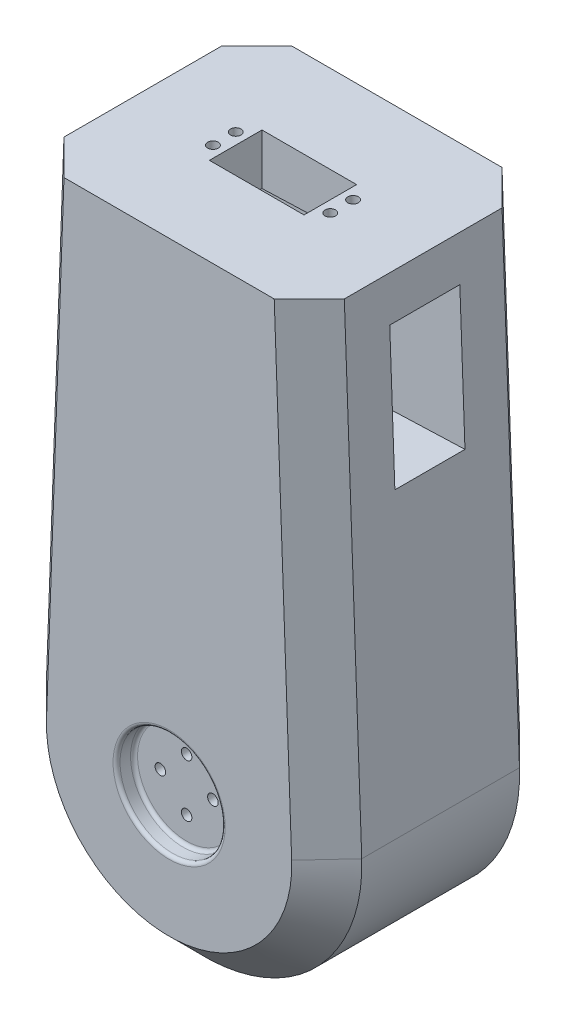
from build123d import *

# Parameters (mm, degrees)
BOSS_EXTRUDE1_DEPTH = 65
CHAMFER2_SIZE       = 10
SKETCH2_R           = 15
CUT_EXTRUDE1_DEPTH  = 5
SKETCH3_R           = 1.5
CUT_EXTRUDE2_DEPTH  = 7.5
FILLET1_R           = 1
SKETCH4_W           = 20
SKETCH4_H           = 40
CUT_EXTRUDE3_DEPTH  = 176.431286259
CUT_EXTRUDE5_REACH  = 200.888
SKETCH5_R           = 1.5
SKETCH5_W           = 27
SKETCH5_H           = 15


with BuildPart() as part:
    # Sketch1 → Boss-Extrude1 (new body)
    with BuildSketch(Plane.XY):
        with BuildLine():
            Line((-40, 137.5), (40, 137.5))
            Line((40, 137.5), (44.969918815, 1.645114527))
            ThreePointArc((44.969918815, 1.645114527), (0, -45), (-44.969918815, 1.645114527))
            Line((-44.969918815, 1.645114527), (-40, 137.5))
        make_face()
    extrude(amount=BOSS_EXTRUDE1_DEPTH)

    # Chamfer2
    chamfer2_edges = [part.edges().sort_by_distance(p)[0] for p in [
        (-42.484959407, 69.572557263, 65),
        (0, -45, 65),
        (-42.484959407, 69.572557263, 0),
        (42.484959407, 69.572557263, 0),
        (0, -45, 0),
        (42.484959407, 69.572557263, 65),
    ]]
    chamfer(chamfer2_edges, length=CHAMFER2_SIZE)

    # Sketch2 → Cut-Extrude1 (cut)
    with BuildSketch(Plane.XY.offset(65)):
        Circle(SKETCH2_R)
    extrude(amount=-CUT_EXTRUDE1_DEPTH, mode=Mode.SUBTRACT)

    # Sketch3 → Cut-Extrude2 (cut)
    with BuildSketch(Plane.XY.offset(60)):
        with Locations((0, 7.5)):
            Circle(SKETCH3_R)
        with Locations((7.5, 0)):
            Circle(SKETCH3_R)
        with Locations((0, -7.5)):
            Circle(SKETCH3_R)
        with Locations((-7.5, 0)):
            Circle(SKETCH3_R)
    extrude(amount=-CUT_EXTRUDE2_DEPTH, mode=Mode.SUBTRACT)

    # Fillet1
    fillet1_edges = [part.edges().sort_by_distance(p)[0] for p in [
        (-15, 0, 60),
        (-15, 0, 65),
    ]]
    fillet(fillet1_edges, radius=FILLET1_R)

    # Sketch4 → Cut-Extrude3 (cut, through all)
    with BuildSketch(Plane(origin=(44.969918815, 1.645114527, 0), x_dir=(0, 0, -1), z_dir=(0.9993315292139455, 0.03655810059230684, 0))):
        with Locations((-32.5, 103.445761243)):
            Rectangle(SKETCH4_W, SKETCH4_H)
    extrude(amount=-CUT_EXTRUDE3_DEPTH, mode=Mode.SUBTRACT)

    # Cut-Extrude5: up to this plane
    cut_extrude5_end = Plane(origin=(-51.096815111, 121.65908428, 42.5), z_dir=(-0.036558100592306846, 0.9993315292139455, 0))
    # Sketch5 → Cut-Extrude5 (cut, up to the surface)
    with BuildSketch(Plane(origin=(0, 137.5, 0), x_dir=(1, 0, 0), z_dir=(0, 1, 0)), mode=Mode.PRIVATE) as cut_extrude5_sk1:
        with Locations(Location((-16.75, -29.25, 0), (0, 0, 270))):
            Circle(SKETCH5_R)
    cut_extrude5_tool1 = split(extrude(cut_extrude5_sk1.sketch, amount=-CUT_EXTRUDE5_REACH, mode=Mode.PRIVATE), bisect_by=cut_extrude5_end, keep=Keep.BOTH, mode=Mode.PRIVATE)
    add(cut_extrude5_tool1.solids().sort_by_distance((-16.75, 137.5, 29.25))[0], mode=Mode.SUBTRACT)
    # Sketch5 → Cut-Extrude5 (cut, up to the surface)
    with BuildSketch(Plane(origin=(0, 137.5, 0), x_dir=(1, 0, 0), z_dir=(0, 1, 0)), mode=Mode.PRIVATE) as cut_extrude5_sk2:
        with Locations((-16.75, -35.75)):
            Circle(SKETCH5_R)
    cut_extrude5_tool2 = split(extrude(cut_extrude5_sk2.sketch, amount=-CUT_EXTRUDE5_REACH, mode=Mode.PRIVATE), bisect_by=cut_extrude5_end, keep=Keep.BOTH, mode=Mode.PRIVATE)
    add(cut_extrude5_tool2.solids().sort_by_distance((-16.75, 137.5, 35.75))[0], mode=Mode.SUBTRACT)
    # Sketch5 → Cut-Extrude5 (cut, up to the surface)
    with BuildSketch(Plane(origin=(0, 137.5, 0), x_dir=(1, 0, 0), z_dir=(0, 1, 0)), mode=Mode.PRIVATE) as cut_extrude5_sk3:
        with Locations(Location((16.75, -35.75, 0), (0, 0, 270))):
            Circle(SKETCH5_R)
    cut_extrude5_tool3 = split(extrude(cut_extrude5_sk3.sketch, amount=-CUT_EXTRUDE5_REACH, mode=Mode.PRIVATE), bisect_by=cut_extrude5_end, keep=Keep.BOTH, mode=Mode.PRIVATE)
    add(cut_extrude5_tool3.solids().sort_by_distance((16.75, 137.5, 35.75))[0], mode=Mode.SUBTRACT)
    # Sketch5 → Cut-Extrude5 (cut, up to the surface)
    with BuildSketch(Plane(origin=(0, 137.5, 0), x_dir=(1, 0, 0), z_dir=(0, 1, 0)), mode=Mode.PRIVATE) as cut_extrude5_sk4:
        with Locations((16.75, -29.25)):
            Circle(SKETCH5_R)
    cut_extrude5_tool4 = split(extrude(cut_extrude5_sk4.sketch, amount=-CUT_EXTRUDE5_REACH, mode=Mode.PRIVATE), bisect_by=cut_extrude5_end, keep=Keep.BOTH, mode=Mode.PRIVATE)
    add(cut_extrude5_tool4.solids().sort_by_distance((16.75, 137.5, 29.25))[0], mode=Mode.SUBTRACT)
    # Sketch5 → Cut-Extrude5 (cut, up to the surface)
    with BuildSketch(Plane(origin=(0, 137.5, 0), x_dir=(1, 0, 0), z_dir=(0, 1, 0)), mode=Mode.PRIVATE) as cut_extrude5_sk5:
        with Locations((0, -32.5)):
            Rectangle(SKETCH5_W, SKETCH5_H)
    cut_extrude5_tool5 = split(extrude(cut_extrude5_sk5.sketch, amount=-CUT_EXTRUDE5_REACH, mode=Mode.PRIVATE), bisect_by=cut_extrude5_end, keep=Keep.BOTH, mode=Mode.PRIVATE)
    add(cut_extrude5_tool5.solids().sort_by_distance((0, 137.5, 32.5))[0], mode=Mode.SUBTRACT)


solid = part.part
